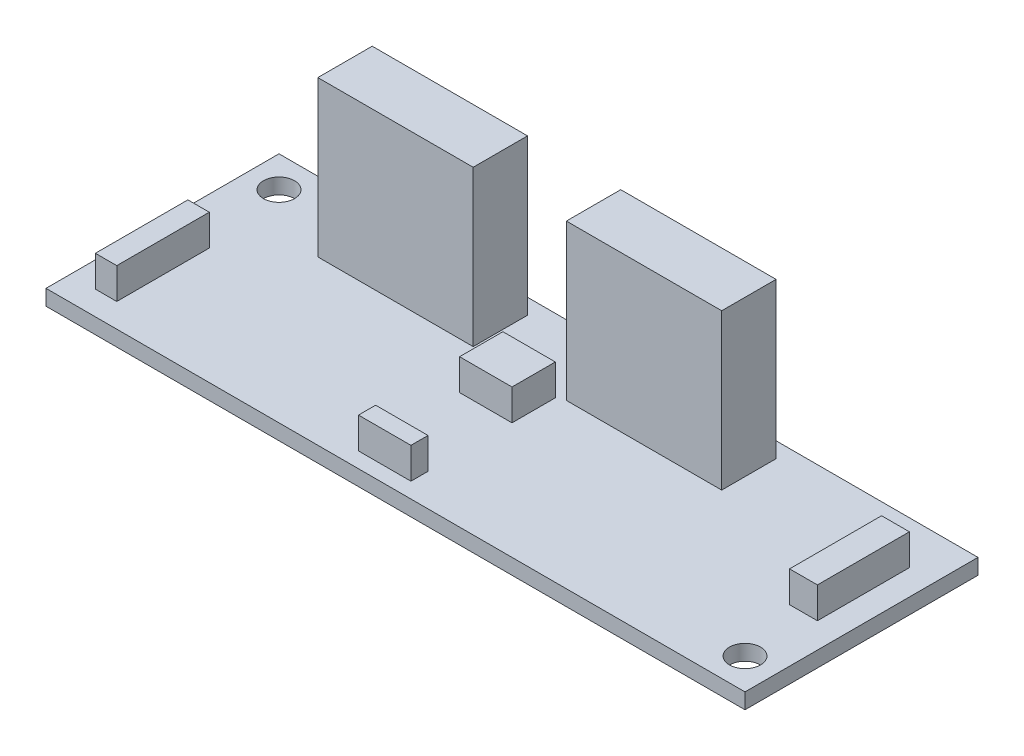
from build123d import *

# Parameters (mm, degrees)
SKETCH1_W           = 45
SKETCH1_H           = 15
SKETCH1_R           = 1
BOSS_EXTRUDE1_DEPTH = 0.5
SKETCH2_W           = 10
SKETCH2_H           = 3.5
BOSS_EXTRUDE2_DEPTH = 10
SKETCH3_W           = 3.374290432
SKETCH3_H           = 2.788954337
SKETCH3_W_2         = 1.377261401
SKETCH3_H_2         = 5.956655559
SKETCH3_H_3         = 1.10180912
SKETCH3_W_3         = 1.790439821
SKETCH3_H_4         = 5.922224024
BOSS_EXTRUDE3_DEPTH = 2


with BuildPart() as part:
    # Sketch1 → Boss-Extrude1 (new, symmetric)
    with BuildSketch(Plane(origin=(0, 0, 0), x_dir=(1, 0, 0), z_dir=(0, 1, 0))):
        Rectangle(SKETCH1_W, SKETCH1_H)
        with Locations(Location((-20.5, 5.5, 0), (0, 0, 270))):
            Circle(SKETCH1_R, mode=Mode.SUBTRACT)
        with Locations(Location((20.5, -5.5, 0), (0, 0, 270))):
            Circle(SKETCH1_R, mode=Mode.SUBTRACT)
    extrude(amount=BOSS_EXTRUDE1_DEPTH, both=True)

    # Sketch2 → Boss-Extrude2 (add)
    with BuildSketch(Plane(origin=(0, 0.5, 0), x_dir=(1, 0, 0), z_dir=(0, 1, 0))):
        with Locations((-10.5, 4.75)):
            Rectangle(SKETCH2_W, SKETCH2_H)
        with Locations((5.5, 4.75)):
            Rectangle(SKETCH2_W, SKETCH2_H)
    extrude(amount=BOSS_EXTRUDE2_DEPTH)

    # Sketch3 → Boss-Extrude3 (add)
    with BuildSketch(Plane(origin=(0, 0.5, 0), x_dir=(1, 0, 0), z_dir=(0, 1, 0))):
        with Locations((-1.687145216, 1.394477169)):
            Rectangle(SKETCH3_W, SKETCH3_H)
        with Locations((-20.176879524, -2.97832778)):
            Rectangle(SKETCH3_W_2, SKETCH3_H_2)
        with Locations((-1.687145216, -5.956655559)):
            Rectangle(SKETCH3_W, SKETCH3_H_3)
        with Locations((19.970290314, 1.756008286)):
            Rectangle(SKETCH3_W_3, SKETCH3_H_4)
    extrude(amount=BOSS_EXTRUDE3_DEPTH)


solid = part.part
